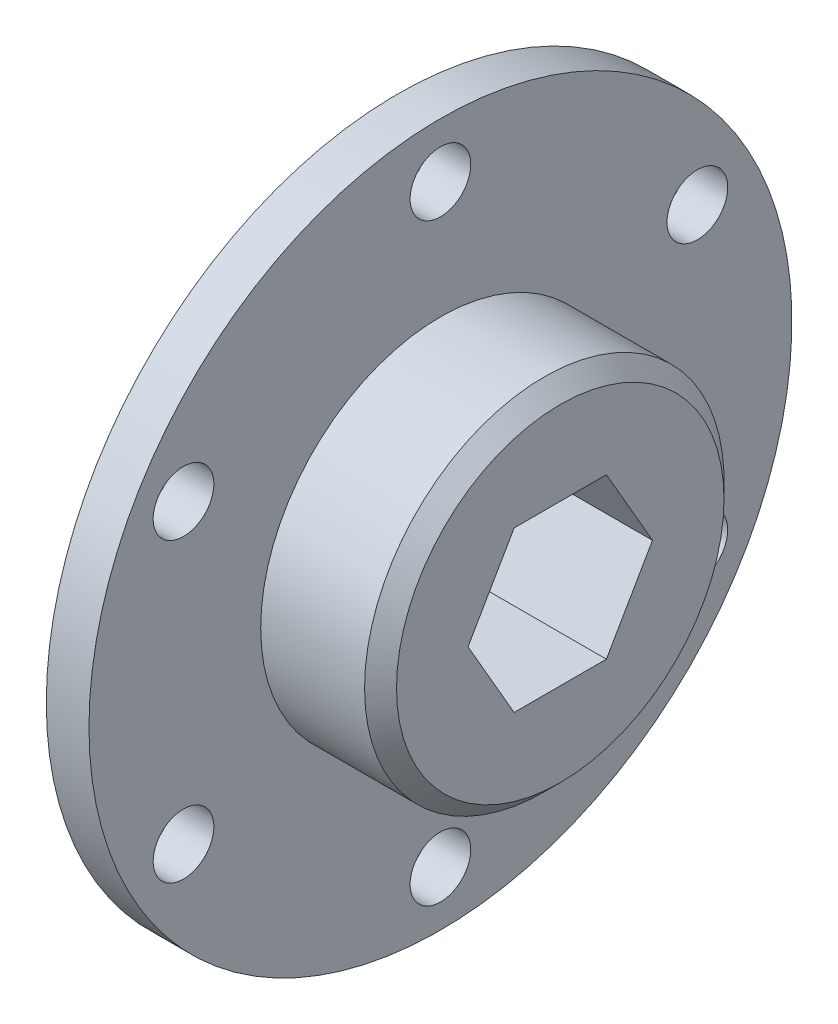
from build123d import *

# Parameters (mm, degrees)
SKETCH1_R           = 27.94
SKETCH1_R_2         = 2.413
BOSS_EXTRUDE1_DEPTH = 3.3909
SKETCH2_R           = 14.2875
BOSS_EXTRUDE2_DEPTH = 9.525
CHAMFER1_SIZE       = 1.27


with BuildPart() as part:
    # Sketch1 → Boss-Extrude1 (new body)
    with BuildSketch(Plane(origin=(0, 0, 0), x_dir=(0, 0, -1), z_dir=(1, 0, 0))):
        with Locations(Location((0, 0, 0), (0, 0, 180))):
            Circle(SKETCH1_R)
        with Locations(Location((0, 23.5839, 0), (0, 0, 180))):
            Circle(SKETCH1_R_2, mode=Mode.SUBTRACT)
        with Locations(Location((20.42425652, 11.79195, 0), (0, 0, 180))):
            Circle(SKETCH1_R_2, mode=Mode.SUBTRACT)
        with Locations(Location((20.42425652, -11.79195, 0), (0, 0, 180))):
            Circle(SKETCH1_R_2, mode=Mode.SUBTRACT)
        with Locations(Location((0, -23.5839, 0), (0, 0, 180))):
            Circle(SKETCH1_R_2, mode=Mode.SUBTRACT)
        with Locations(Location((-20.42425652, -11.79195, 0), (0, 0, 180))):
            Circle(SKETCH1_R_2, mode=Mode.SUBTRACT)
        with Locations(Location((-20.42425652, 11.79195, 0), (0, 0, 180))):
            Circle(SKETCH1_R_2, mode=Mode.SUBTRACT)
        Polygon((7.332348419, 0), (3.666174209, 6.35), (-3.666174209, 6.35), (-7.332348419, 0), (-3.666174209, -6.35), (3.666174209, -6.35), align=None, mode=Mode.SUBTRACT)
    extrude(amount=BOSS_EXTRUDE1_DEPTH)

    # Sketch2 → Boss-Extrude2 (add)
    with BuildSketch(Plane(origin=(3.3909, 0, 0), x_dir=(0, 0, -1), z_dir=(1, 0, 0))):
        with Locations(Location((0, 0, 0), (0, 0, 180))):
            Circle(SKETCH2_R)
        Polygon((3.666174209, -6.35), (7.332348419, 0), (3.666174209, 6.35), (-3.666174209, 6.35), (-7.332348419, 0), (-3.666174209, -6.35), align=None, mode=Mode.SUBTRACT)
    extrude(amount=BOSS_EXTRUDE2_DEPTH)

    # Chamfer1
    chamfer1_edges = [part.edges().sort_by_distance(p)[0] for p in [
        (12.9159, 0, -14.2875),
    ]]
    chamfer(chamfer1_edges, length=CHAMFER1_SIZE)


solid = part.part
